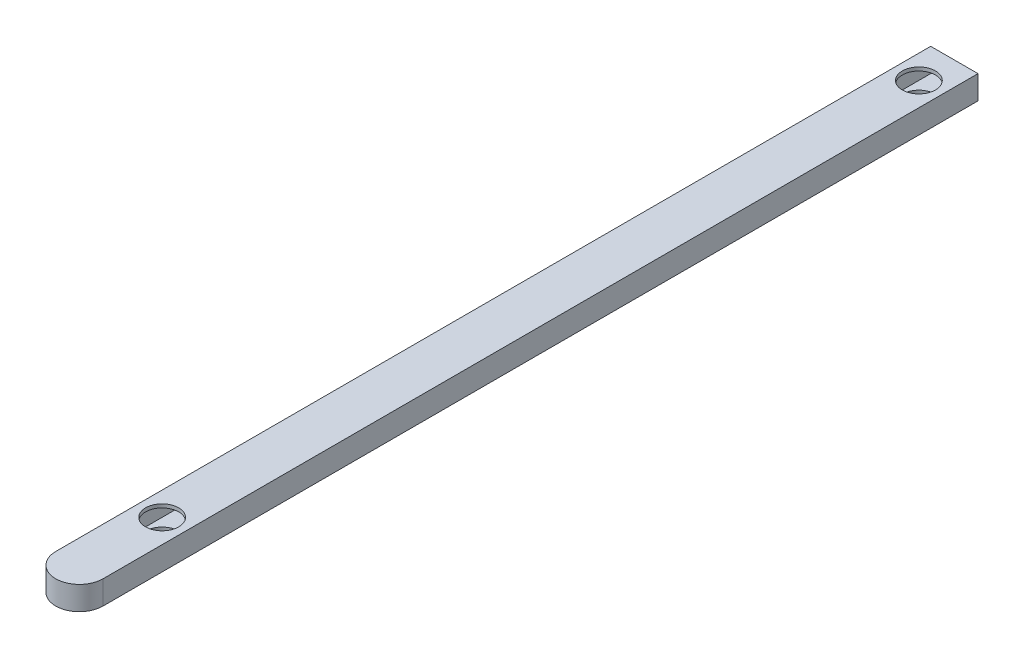
from build123d import *

# Parameters (mm, degrees)
SKETCH_1_W          = 20
SKETCH_1_H          = 10
SKETCH_1_W_2        = 17
SKETCH_1_H_2        = 7
EXTRUDE_1_DEPTH     = 370
SKETCH_2_R          = 7
CUT_EXTRUDE_1_DEPTH = 10
EXTRUDE_2_DEPTH     = 10


with BuildPart() as part:
    # 草图1 → 凸台-拉伸1 (new body)
    with BuildSketch(Plane.XY):
        Rectangle(SKETCH_1_W, SKETCH_1_H)
        Rectangle(SKETCH_1_W_2, SKETCH_1_H_2, mode=Mode.SUBTRACT)
    extrude(amount=EXTRUDE_1_DEPTH)

    # 草图2 → 切除-拉伸1 (cut)
    with BuildSketch(Plane(origin=(0, 5, 0), x_dir=(1, 0, 0), z_dir=(0, 1, 0))):
        with Locations(Location((0, -15, 0), (0, 0, 270))):
            Circle(SKETCH_2_R)
        with Locations(Location((0, -335, 0), (0, 0, 270))):
            Circle(SKETCH_2_R)
    extrude(amount=-CUT_EXTRUDE_1_DEPTH, mode=Mode.SUBTRACT)

    # 草图3 → 凸台-拉伸2 (add)
    with BuildSketch(Plane(origin=(0, 5, 0), x_dir=(1, 0, 0), z_dir=(0, 1, 0))):
        with BuildLine():
            Line((-10, -370), (10, -370))
            ThreePointArc((10, -370), (0, -380), (-10, -370))
        make_face()
    extrude(amount=-EXTRUDE_2_DEPTH)


solid = part.part
